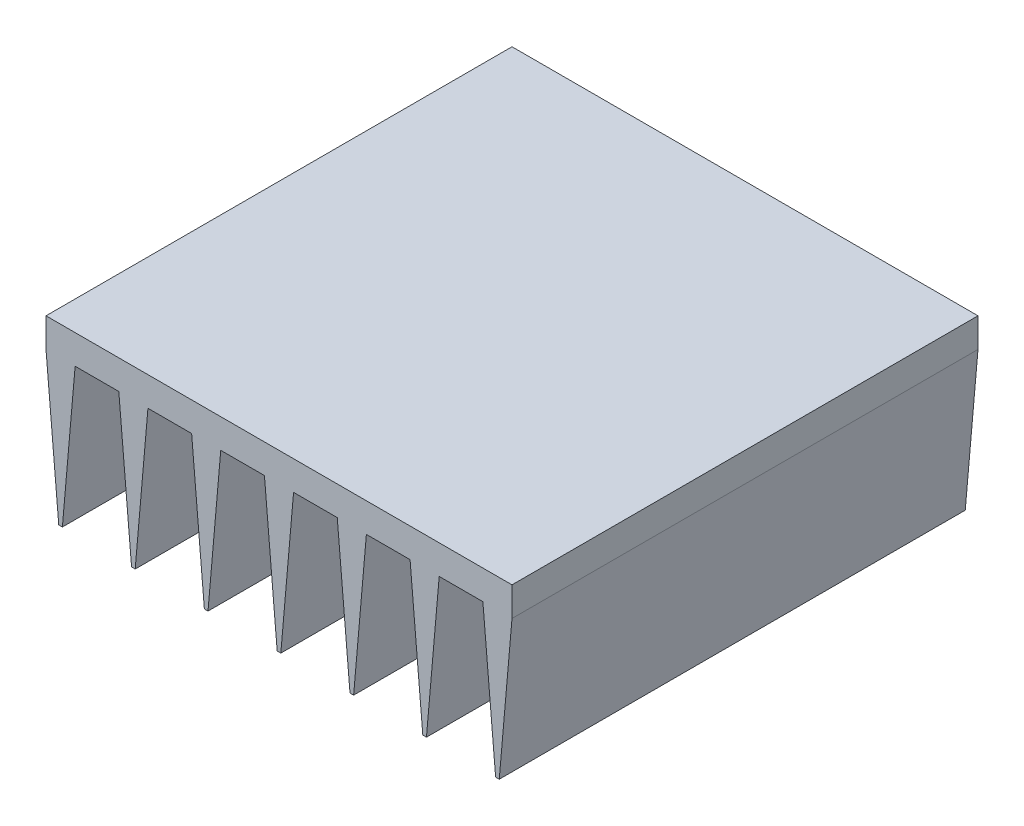
from build123d import *

# Parameters (mm, degrees)
SKETCH1_W           = 50.8
SKETCH1_H           = 50.8
BOSS_EXTRUDE1_DEPTH = 3.175
BOSS_EXTRUDE2_DEPTH = 50.8
LPATTERN1_COUNT     = 7
LPATTERN1_PITCH     = 7.9375


with BuildPart() as part:
    # Sketch1 → Boss-Extrude1 (new body)
    with BuildSketch(Plane(origin=(0, 0, 0), x_dir=(1, 0, 0), z_dir=(0, 1, 0))):
        Rectangle(SKETCH1_W, SKETCH1_H)
    extrude(amount=-BOSS_EXTRUDE1_DEPTH)

    # Sketch2 → Boss-Extrude2 (add, through all)
    with BuildSketch(Plane.XY.offset(25.4)):
        Polygon((-25.4, -3.175), (-24.01062, -19.05), (-23.61438, -19.05), (-22.225, -3.175), align=None)
    boss_extrude2 = extrude(amount=-BOSS_EXTRUDE2_DEPTH)

    # LPattern1: Boss-Extrude2 ×7
    with Locations(*[(i * LPATTERN1_PITCH, 0, 0) for i in range(1, LPATTERN1_COUNT)]):
        add(boss_extrude2)


solid = part.part
